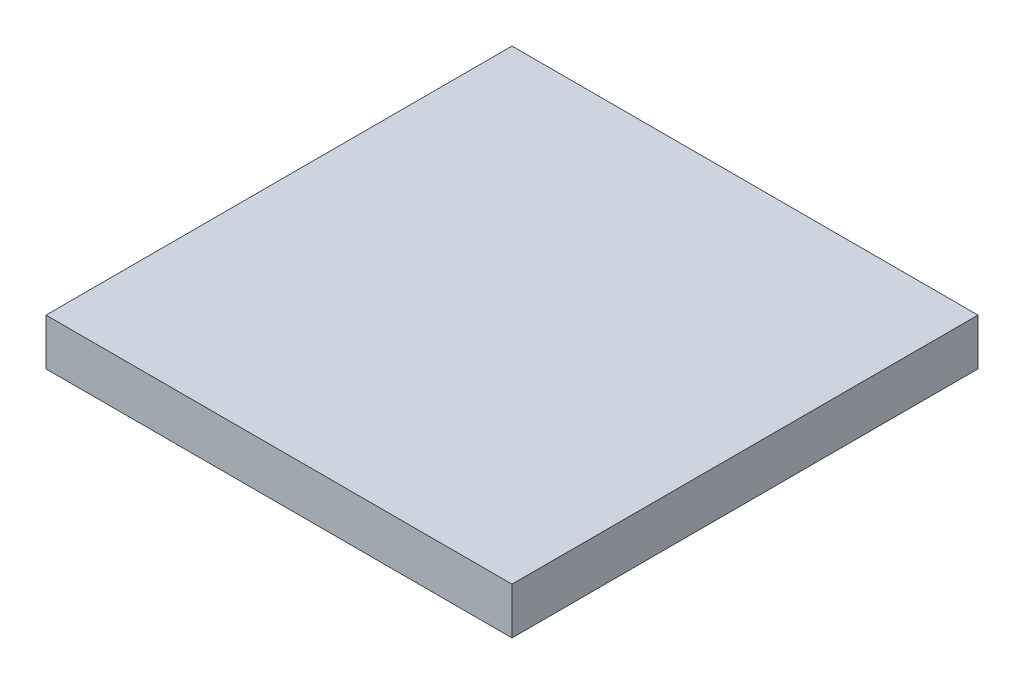
from build123d import *

# Parameters (mm, degrees)
SKETCH1_W           = 10
SKETCH1_H           = 10
BOSS_EXTRUDE1_DEPTH = 1


with BuildPart() as part:
    # Sketch1 → Boss-Extrude1 (new body)
    with BuildSketch(Plane(origin=(0, 0, 0), x_dir=(1, 0, 0), z_dir=(0, 1, 0))):
        with Locations((5, 5)):
            Rectangle(SKETCH1_W, SKETCH1_H)
    extrude(amount=BOSS_EXTRUDE1_DEPTH)


solid = part.part
